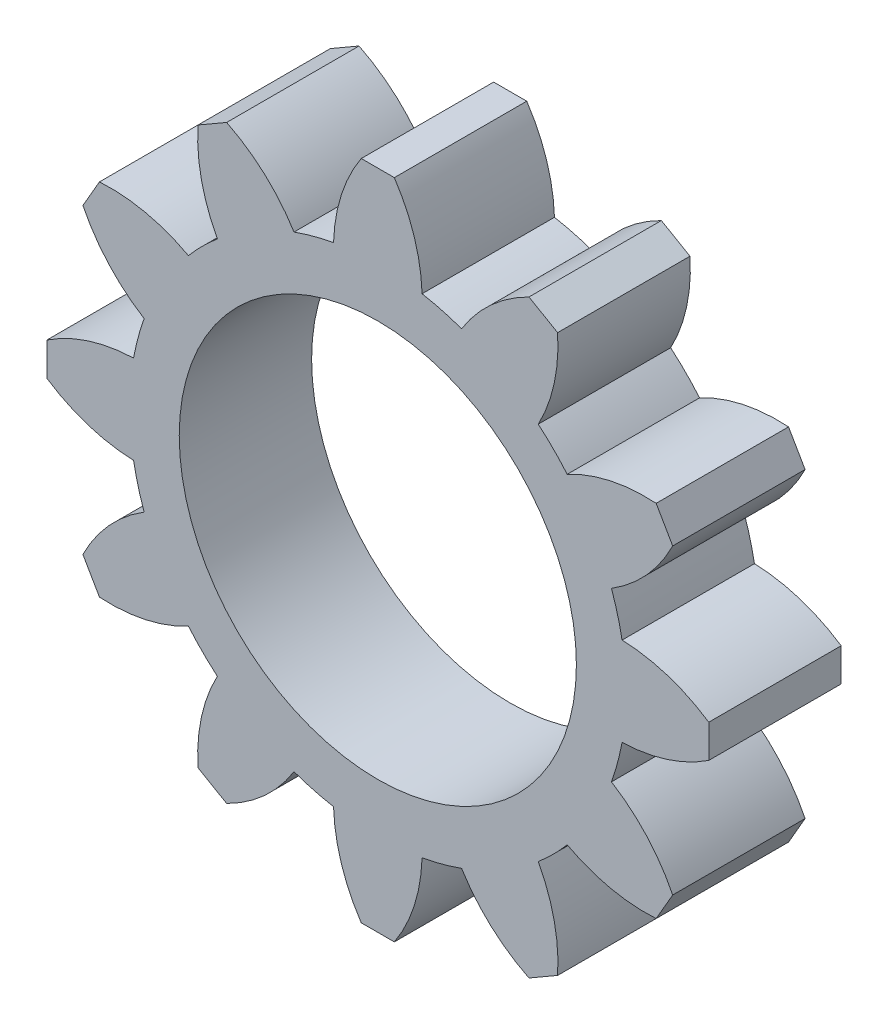
from build123d import *

# Parameters (mm, degrees)
SKETCH1_R           = 12
BOSS_EXTRUDE1_DEPTH = 8


with BuildPart() as part:
    # Sketch1 → Boss-Extrude1 (new body)
    with BuildSketch(Plane.XY):
        with BuildLine():
            Line((-1, 20), (1, 20))
            ThreePointArc((1, 20), (2.204975942, 17.497232023), (2.675, 14.759551992))
            ThreePointArc((2.675, 14.759551992), (3.882285677, 14.488887394), (5.063158041, 14.119646973))
            ThreePointArc((5.063158041, 14.119646973), (6.839050831, 16.255535399), (9.133974596, 17.820508076))
            Line((9.133974596, 17.820508076), (10.866025404, 16.820508076))
            ThreePointArc((10.866025404, 16.820508076), (10.658181192, 14.050559457), (9.696393951, 11.444646973))
            ThreePointArc((9.696393951, 11.444646973), (10.606601718, 10.606601718), (11.444646973, 9.696393951))
            ThreePointArc((11.444646973, 9.696393951), (14.050559457, 10.658181192), (16.820508076, 10.866025404))
            Line((16.820508076, 10.866025404), (17.820508076, 9.133974596))
            ThreePointArc((17.820508076, 9.133974596), (16.255535399, 6.839050831), (14.119646973, 5.063158041))
            ThreePointArc((14.119646973, 5.063158041), (14.488887394, 3.882285677), (14.759551992, 2.675))
            ThreePointArc((14.759551992, 2.675), (17.497232023, 2.204975942), (20, 1))
            Line((20, 1), (20, -1))
            ThreePointArc((20, -1), (17.497232023, -2.204975942), (14.759551992, -2.675))
            ThreePointArc((14.759551992, -2.675), (14.488887394, -3.882285677), (14.119646973, -5.063158041))
            ThreePointArc((14.119646973, -5.063158041), (16.255535399, -6.839050831), (17.820508076, -9.133974596))
            Line((17.820508076, -9.133974596), (16.820508076, -10.866025404))
            ThreePointArc((16.820508076, -10.866025404), (14.050559457, -10.658181192), (11.444646973, -9.696393951))
            ThreePointArc((11.444646973, -9.696393951), (10.606601718, -10.606601718), (9.696393951, -11.444646973))
            ThreePointArc((9.696393951, -11.444646973), (10.658181192, -14.050559457), (10.866025404, -16.820508076))
            Line((10.866025404, -16.820508076), (9.133974596, -17.820508076))
            ThreePointArc((9.133974596, -17.820508076), (6.839050831, -16.255535399), (5.063158041, -14.119646973))
            ThreePointArc((5.063158041, -14.119646973), (3.882285677, -14.488887394), (2.675, -14.759551992))
            ThreePointArc((2.675, -14.759551992), (2.204975942, -17.497232023), (1, -20))
            Line((1, -20), (-1, -20))
            ThreePointArc((-1, -20), (-2.204975942, -17.497232023), (-2.675, -14.759551992))
            ThreePointArc((-2.675, -14.759551992), (-3.882285677, -14.488887394), (-5.063158041, -14.119646973))
            ThreePointArc((-5.063158041, -14.119646973), (-6.839050831, -16.255535399), (-9.133974596, -17.820508076))
            Line((-9.133974596, -17.820508076), (-10.866025404, -16.820508076))
            ThreePointArc((-10.866025404, -16.820508076), (-10.658181192, -14.050559457), (-9.696393951, -11.444646973))
            ThreePointArc((-9.696393951, -11.444646973), (-10.606601718, -10.606601718), (-11.444646973, -9.696393951))
            ThreePointArc((-11.444646973, -9.696393951), (-14.050559457, -10.658181192), (-16.820508076, -10.866025404))
            Line((-16.820508076, -10.866025404), (-17.820508076, -9.133974596))
            ThreePointArc((-17.820508076, -9.133974596), (-16.255535399, -6.839050831), (-14.119646973, -5.063158041))
            ThreePointArc((-14.119646973, -5.063158041), (-14.488887394, -3.882285677), (-14.759551992, -2.675))
            ThreePointArc((-14.759551992, -2.675), (-17.497232023, -2.204975942), (-20, -1))
            Line((-20, -1), (-20, 1))
            ThreePointArc((-20, 1), (-17.497232023, 2.204975942), (-14.759551992, 2.675))
            ThreePointArc((-14.759551992, 2.675), (-14.488887394, 3.882285677), (-14.119646973, 5.063158041))
            ThreePointArc((-14.119646973, 5.063158041), (-16.255535399, 6.839050831), (-17.820508076, 9.133974596))
            Line((-17.820508076, 9.133974596), (-16.820508076, 10.866025404))
            ThreePointArc((-16.820508076, 10.866025404), (-14.050559457, 10.658181192), (-11.444646973, 9.696393951))
            ThreePointArc((-11.444646973, 9.696393951), (-10.606601718, 10.606601718), (-9.696393951, 11.444646973))
            ThreePointArc((-9.696393951, 11.444646973), (-10.658181192, 14.050559457), (-10.866025404, 16.820508076))
            Line((-10.866025404, 16.820508076), (-9.133974596, 17.820508076))
            ThreePointArc((-9.133974596, 17.820508076), (-6.839050831, 16.255535399), (-5.063158041, 14.119646973))
            ThreePointArc((-5.063158041, 14.119646973), (-3.882285677, 14.488887394), (-2.675, 14.759551992))
            ThreePointArc((-2.675, 14.759551992), (-2.204975942, 17.497232023), (-1, 20))
        make_face()
        Circle(SKETCH1_R, mode=Mode.SUBTRACT)
    extrude(amount=BOSS_EXTRUDE1_DEPTH)


solid = part.part
